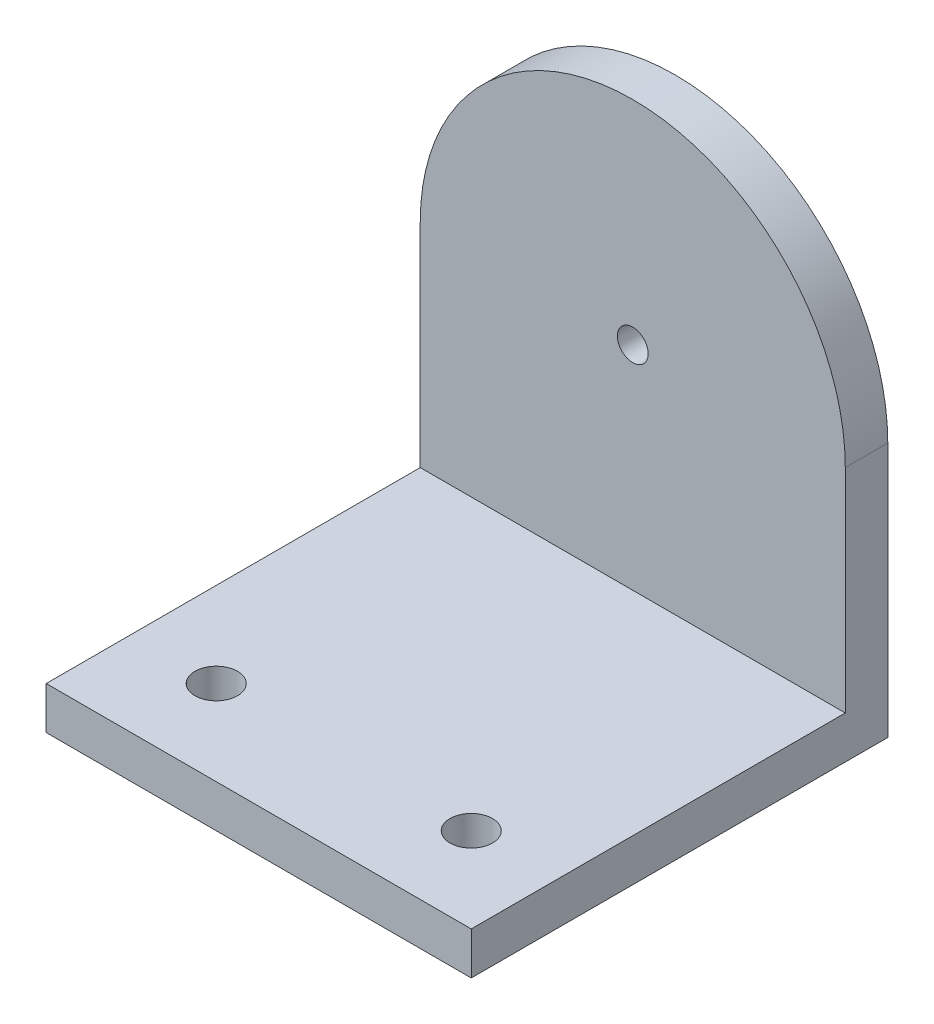
from build123d import *

# Parameters (mm, degrees)
BOSS_EXTRUDE1_DEPTH = 3.175
SKETCH4_W           = 31.75
SKETCH4_H           = 3.175
BOSS_EXTRUDE2_DEPTH = 27.94
SKETCH5_R           = 1.5875
CUT_EXTRUDE2_DEPTH  = 48.204039552
SKETCH6_R           = 1.15
CUT_EXTRUDE3_DEPTH  = 38.357217843


with BuildPart() as part:
    # Sketch1 → Boss-Extrude1 (new body)
    with BuildSketch(Plane.XY):
        with BuildLine():
            ThreePointArc((15.875, 0), (0, 15.875), (-15.875, 0))
            Line((-15.875, 0), (15.875, 0))
        make_face()
        with BuildLine():
            ThreePointArc((15.875, 0), (0, -15.875), (-15.875, 0))
            Line((-15.875, 0), (-15.875, -19.05))
            Line((-15.875, -19.05), (15.875, -19.05))
            Line((15.875, -19.05), (15.875, 0))
        make_face()
        with BuildLine():
            Line((15.875, 0), (-15.875, 0))
            ThreePointArc((-15.875, 0), (0, -15.875), (15.875, 0))
        make_face()
    extrude(amount=BOSS_EXTRUDE1_DEPTH)

    # Sketch4 → Boss-Extrude2 (add)
    with BuildSketch(Plane.XY.offset(3.175)):
        with Locations((0, -17.4625)):
            Rectangle(SKETCH4_W, SKETCH4_H)
    extrude(amount=BOSS_EXTRUDE2_DEPTH)

    # Sketch5 → Cut-Extrude2 (cut, through all)
    with BuildSketch(Plane(origin=(0, -15.875, 0), x_dir=(1, 0, 0), z_dir=(0, 1, 0))):
        with Locations(Location((-9.525, -24.765, 0), (0, 0, 270))):
            Circle(SKETCH5_R)
        with Locations(Location((9.525, -24.765, 0), (0, 0, 90))):
            Circle(SKETCH5_R)
    extrude(amount=-CUT_EXTRUDE2_DEPTH, mode=Mode.SUBTRACT)

    # Sketch6 → Cut-Extrude3 (cut, through all)
    with BuildSketch(Plane.XY.offset(3.175)):
        Circle(SKETCH6_R)
    extrude(amount=-CUT_EXTRUDE3_DEPTH, mode=Mode.SUBTRACT)


solid = part.part
